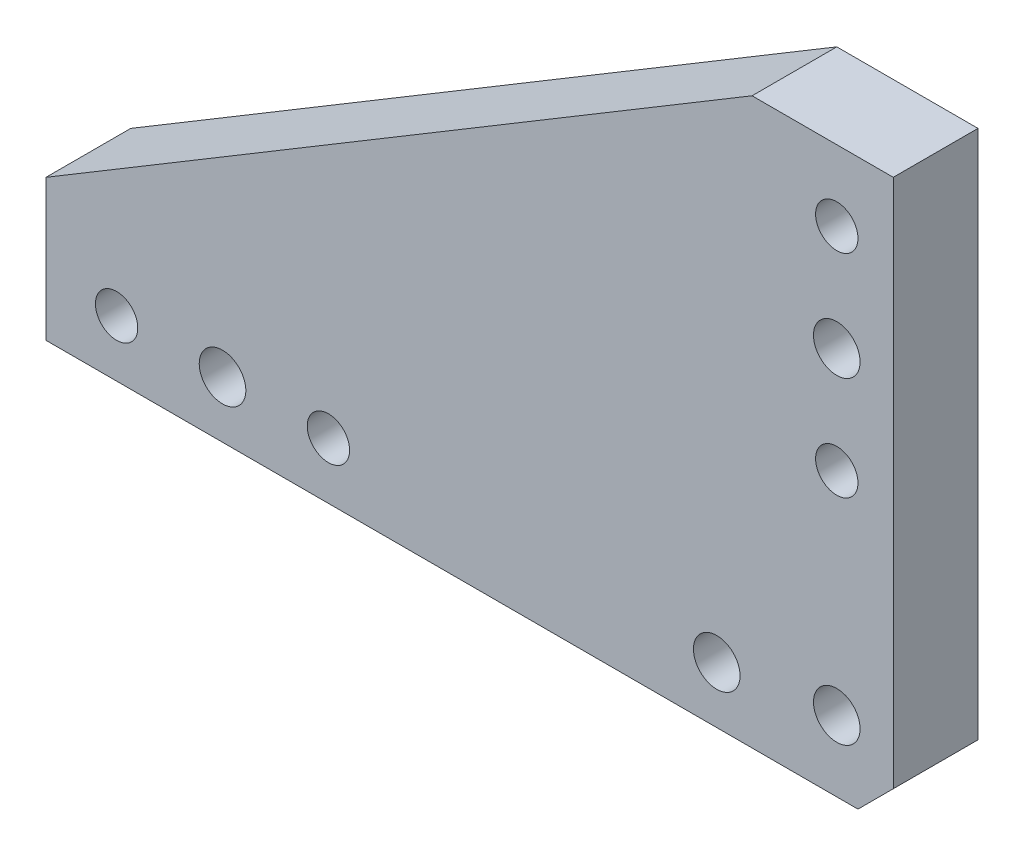
from build123d import *

# Parameters (mm, degrees)
SKETCH_1_W         = 120
SKETCH_1_H         = 80
EXTRUDE_1_DEPTH    = 12
CHAMFER_1_SIZE     = 100
CHAMFER_1_SIZE2    = 60
CHAMFER_2_SIZE     = 5
MM_1_D             = 6
HOLE_WIZARD_M6_1_D = 6.6


with BuildPart() as part:
    # 草图1 → 凸台-拉伸1 (new body)
    with BuildSketch(Plane.XY):
        Rectangle(SKETCH_1_W, SKETCH_1_H)
    extrude(amount=EXTRUDE_1_DEPTH)

    # 倒角1
    chamfer_1_edges = [part.edges().sort_by_distance(p)[0] for p in [
        (-60, 40, 6),
    ]]
    chamfer_1_side = [part.faces().sort_by_distance(p)[0] for p in [
        (0, 40, 6),
    ]]
    chamfer(chamfer_1_edges, length=CHAMFER_1_SIZE, length2=CHAMFER_1_SIZE2, reference=chamfer_1_side[0])

    # 倒角2
    chamfer_2_edges = [part.edges().sort_by_distance(p)[0] for p in [
        (60, -40, 6),
    ]]
    chamfer(chamfer_2_edges, length=CHAMFER_2_SIZE)

    # 大小mm 暗销孔1 (through all)
    with Locations(Plane(origin=(0, 0, 0), x_dir=(-1, 0, 0), z_dir=(0, 0, -1))):
        with Locations((50, -32), (20, -32), (-52, 30), (-52, 0)):
            Hole(MM_1_D / 2)

    # M6 间隙孔1 (through all)
    with Locations(Plane(origin=(0, 0, 0), x_dir=(-1, 0, 0), z_dir=(0, 0, -1))):
        with Locations((-52, 15), (-52, -30), (-35, -32), (35, -32)):
            Hole(HOLE_WIZARD_M6_1_D / 2)


solid = part.part
